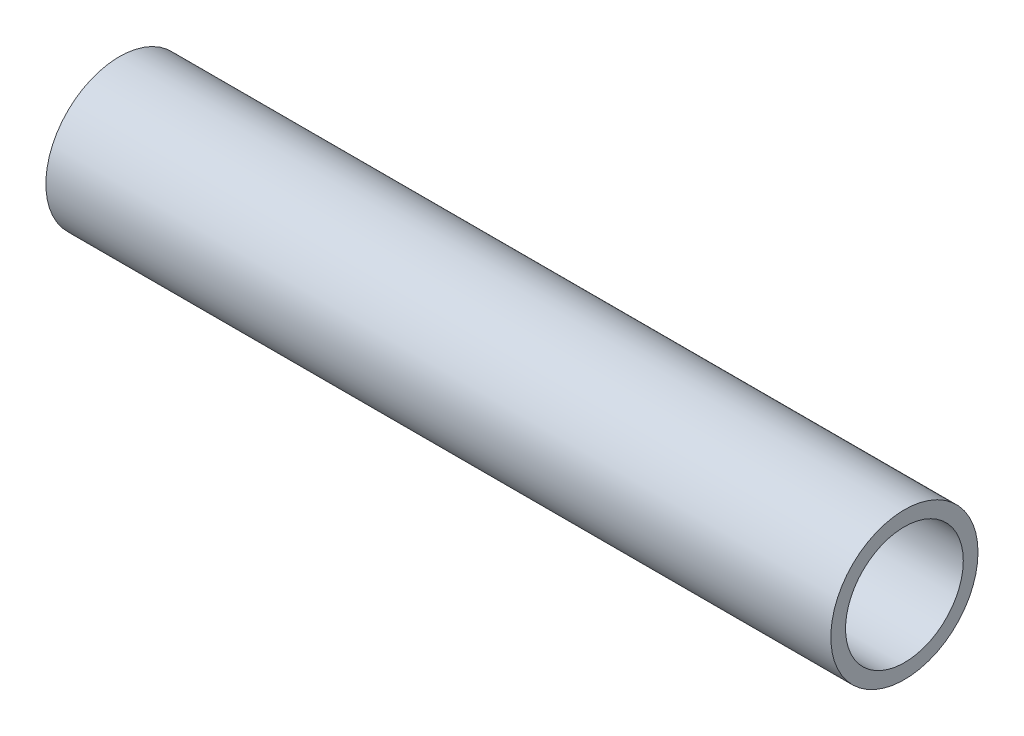
from build123d import *

# Parameters (mm, degrees)
BOSS_EXTRUDE1_DEPTH      = 40
BOSS_EXTRUDE1_DEPTH_BACK = 40
SKETCH1_R                = 7.5
SKETCH1_R_2              = 6


with BuildPart() as part:
    # Sketch1 → Boss-Extrude1 (new, two sides: drawn at the far end of the back side and taken through both)
    with BuildSketch(Plane(origin=(0, 0, 0), x_dir=(0, 0, -1), z_dir=(1, 0, 0)).offset(-BOSS_EXTRUDE1_DEPTH_BACK)):
        Circle(SKETCH1_R)
        Circle(SKETCH1_R_2, mode=Mode.SUBTRACT)
    extrude(amount=BOSS_EXTRUDE1_DEPTH + BOSS_EXTRUDE1_DEPTH_BACK)


solid = part.part
